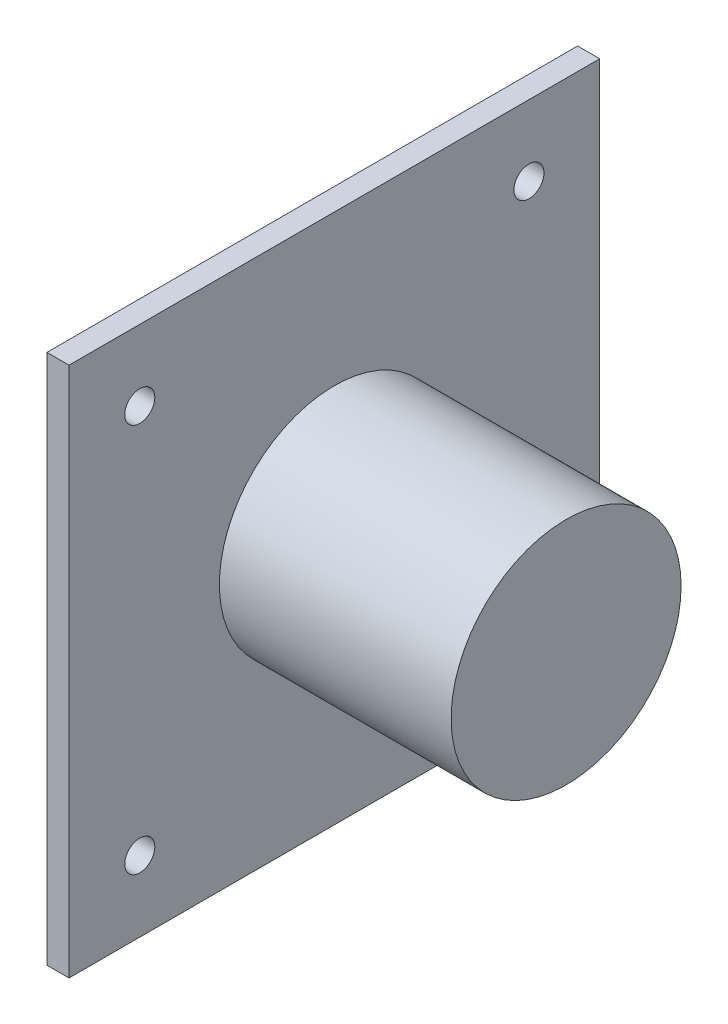
from build123d import *

# Parameters (mm, degrees)
SKETCH1_W           = 38.1
SKETCH1_H           = 38.1
SKETCH1_R           = 1.0795
BOSS_EXTRUDE1_DEPTH = 1.5875
SKETCH3_W           = 10.16
SKETCH3_H           = 5.08
BOSS_EXTRUDE2_DEPTH = 8.89
SKETCH4_R           = 8.255
BOSS_EXTRUDE3_DEPTH = 16.637


with BuildPart() as part:
    # Sketch1 → Boss-Extrude1 (new body)
    with BuildSketch(Plane(origin=(0, 0, 0), x_dir=(0, 0, -1), z_dir=(1, 0, 0))):
        Rectangle(SKETCH1_W, SKETCH1_H)
        with Locations((13.97, -13.97)):
            Circle(SKETCH1_R, mode=Mode.SUBTRACT)
        with Locations((-13.97, -13.97)):
            Circle(SKETCH1_R, mode=Mode.SUBTRACT)
        with Locations((-13.97, 13.97)):
            Circle(SKETCH1_R, mode=Mode.SUBTRACT)
        with Locations((13.97, 13.97)):
            Circle(SKETCH1_R, mode=Mode.SUBTRACT)
    extrude(amount=BOSS_EXTRUDE1_DEPTH)

    # Sketch3 → Boss-Extrude2 (add)
    with BuildSketch(Plane.ZY):
        with Locations((-6.35, -12.7)):
            Rectangle(SKETCH3_W, SKETCH3_H)
    extrude(amount=BOSS_EXTRUDE2_DEPTH)

    # Sketch4 → Boss-Extrude3 (add)
    with BuildSketch(Plane(origin=(1.5875, 0, 0), x_dir=(0, 0, -1), z_dir=(1, 0, 0))):
        Circle(SKETCH4_R)
    extrude(amount=BOSS_EXTRUDE3_DEPTH)


solid = part.part
